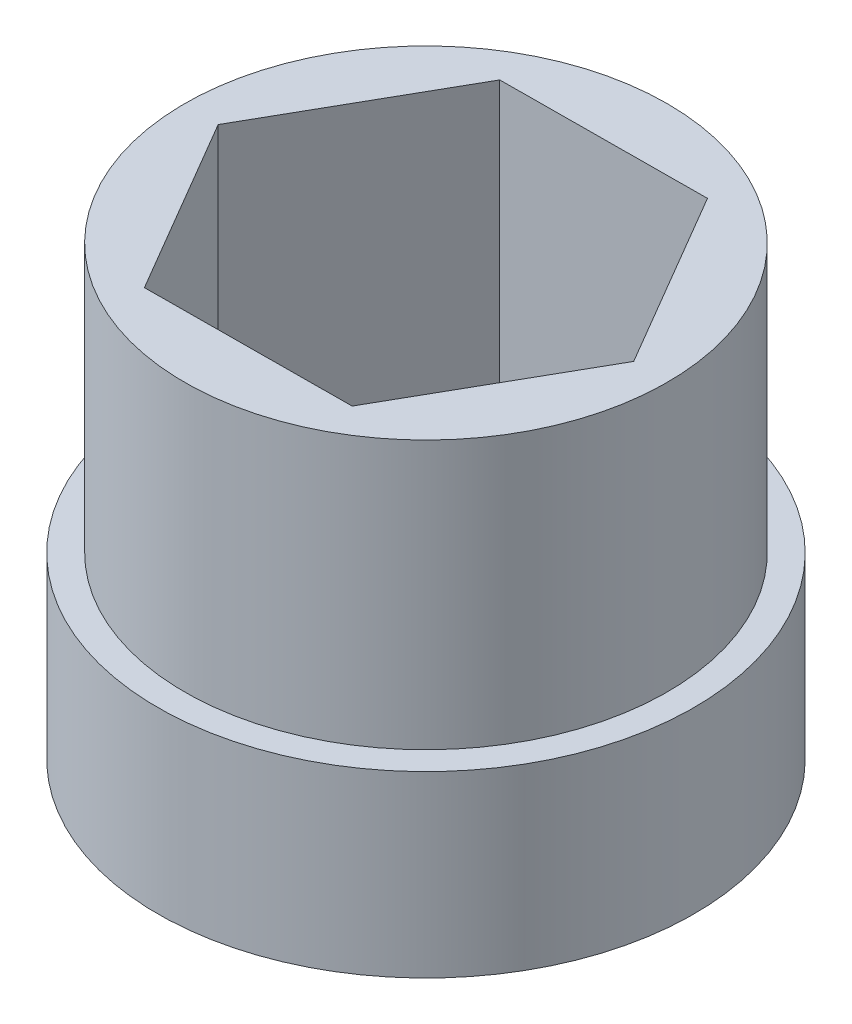
from build123d import *

# Parameters (mm, degrees)
SKETCH1_R           = 8.5725
BOSS_EXTRUDE1_DEPTH = 9.525
SKETCH2_R           = 9.525
BOSS_EXTRUDE2_DEPTH = 3.175
SKETCH3_R           = 9.525
BOSS_EXTRUDE3_DEPTH = 3.175


with BuildPart() as part:
    # Sketch1 → Boss-Extrude1 (new body)
    with BuildSketch(Plane(origin=(0, 0, 0), x_dir=(1, 0, 0), z_dir=(0, 1, 0))):
        with Locations(Location((0, 0, 0), (0, 0, 90))):
            Circle(SKETCH1_R)
        Polygon((3.626024097, 6.373012049), (-3.706178285, 6.326735007), (-7.332202382, -0.046277042), (-3.626024097, -6.373012049), (3.706178285, -6.326735007), (7.332202382, 0.046277042), align=None, mode=Mode.SUBTRACT)
    extrude(amount=BOSS_EXTRUDE1_DEPTH)

    # Sketch2 → Boss-Extrude2 (add)
    with BuildSketch(Plane.XZ):
        with Locations(Location((0, 0, 0), (0, 0, 270))):
            Circle(SKETCH2_R)
    extrude(amount=BOSS_EXTRUDE2_DEPTH)

    # Sketch3 → Boss-Extrude3 (add)
    with BuildSketch(Plane.XZ.offset(3.175)):
        with Locations(Location((0, 0, 0), (0, 0, 270))):
            Circle(SKETCH3_R)
        with BuildLine():
            ThreePointArc((-6.791694669, 0.268500499), (-6.796999648, 0.002188773), (-6.791866186, -0.264126315))
            add(Edge.make_bspline(
                [(-6.791866186, -0.264126315), (-6.828456429, -0.284505488), (-6.88374772, -0.316794554), (-6.957522308, -0.362792819), (-7.015139929, -0.400315137), (-7.073957946, -0.440278462), (-7.133872896, -0.48277978), (-7.194920131, -0.527737667), (-7.267400097, -0.584182527), (-7.324227079, -0.627570578), (-7.360808821, -0.661044511), (-7.368826881, -0.671334712), (-7.375185479, -0.681753711), (-7.380216924, -0.692887617), (-7.383837872, -0.704544545), (-7.386706284, -0.719753225), (-7.386105651, -0.746389435), (-7.381105605, -0.783577736), (-7.376641717, -0.82874241), (-7.3709726, -0.873771681), (-7.367596177, -0.91114239), (-7.362271448, -0.937247863), (-7.356099843, -0.951440926), (-7.34998257, -0.962003796), (-7.342606019, -0.971743703), (-7.334094032, -0.980492038), (-7.32399253, -0.988746564), (-7.280895102, -1.013268793), (-7.215857254, -1.042965715), (-7.132659421, -1.081920666), (-7.06315819, -1.112211845), (-6.995306114, -1.140358941), (-6.929086788, -1.166274715), (-6.864579576, -1.190076694), (-6.782437421, -1.218558205), (-6.721359767, -1.237773588), (-6.681159686, -1.24952561)],
                knots=[6.3172e-05, 6.3172e-05, 6.3172e-05, 6.3172e-05, 0.072334925, 0.110530585, 0.150078376, 0.190978298, 0.233230352, 0.276834537, 0.321790853, 0.391759161, 0.400170221, 0.407178031, 0.414185842, 0.421193653, 0.428201463, 0.435209274, 0.447801873, 0.473901424, 0.5, 0.526098576, 0.552198127, 0.564790726, 0.571798537, 0.578806347, 0.585814158, 0.592821969, 0.599829779, 0.608240839, 0.678209147, 0.723165463, 0.766769648, 0.809021702, 0.849921624, 0.889469415, 0.927665075, 0.999936828, 0.999936828, 0.999936828, 0.999936828], degree=3))
            ThreePointArc((-6.681159686, -1.24952561), (-6.627071723, -1.510340814), (-6.562806286, -1.768836524))
            add(Edge.make_bspline(
                [(-6.562806286, -1.768836524), (-6.593944342, -1.796846843), (-6.640664373, -1.840629825), (-6.702353701, -1.901891208), (-6.750177226, -1.951293889), (-6.798627876, -2.00334349), (-6.8475832, -2.058111543), (-6.897095784, -2.115526529), (-6.955198362, -2.186684508), (-7.000945823, -2.241629924), (-7.029161734, -2.282404798), (-7.03468898, -2.294221189), (-7.038569708, -2.305793883), (-7.040997477, -2.31776824), (-7.04193373, -2.329938642), (-7.041345976, -2.345404291), (-7.034833288, -2.371239022), (-7.021683427, -2.406382319), (-7.007281373, -2.449421312), (-6.991734437, -2.492060107), (-6.980126903, -2.527742531), (-6.969126662, -2.552008621), (-6.959951539, -2.564472523), (-6.951637179, -2.573409339), (-6.942278239, -2.581263608), (-6.932032978, -2.58789851), (-6.920347937, -2.593698281), (-6.872874343, -2.608015607), (-6.802858942, -2.622495683), (-6.71307876, -2.641960692), (-6.638579649, -2.656026929), (-6.566165448, -2.668369812), (-6.495839577, -2.678900637), (-6.427653257, -2.687751645), (-6.341232844, -2.697240716), (-6.27741071, -2.702383272), (-6.235603458, -2.704895287)],
                knots=[6.3172e-05, 6.3172e-05, 6.3172e-05, 6.3172e-05, 0.072334925, 0.110530585, 0.150078376, 0.190978298, 0.233230352, 0.276834537, 0.321790853, 0.391759161, 0.400170221, 0.407178031, 0.414185842, 0.421193653, 0.428201463, 0.435209274, 0.447801873, 0.473901424, 0.5, 0.526098576, 0.552198127, 0.564790726, 0.571798537, 0.578806347, 0.585814158, 0.592821969, 0.599829779, 0.608240839, 0.678209147, 0.723165463, 0.766769648, 0.809021702, 0.849921624, 0.889469415, 0.927665075, 0.999936828, 0.999936828, 0.999936828, 0.999936828], degree=3))
            ThreePointArc((-6.235603458, -2.704895287), (-6.124834751, -2.947135606), (-6.004659875, -3.184849883))
            add(Edge.make_bspline(
                [(-6.004659875, -3.184849883), (-6.028784353, -3.219086795), (-6.064590385, -3.272168231), (-6.111101092, -3.34562083), (-6.146732451, -3.404426618), (-6.182386217, -3.465952511), (-6.21792709, -3.530240999), (-6.253422253, -3.597234058), (-6.294233939, -3.679536998), (-6.326607911, -3.743284585), (-6.345043126, -3.789315779), (-6.347802398, -3.802065836), (-6.349010662, -3.814211921), (-6.348713017, -3.826426286), (-6.346917627, -3.838499886), (-6.342903178, -3.853446991), (-6.330805008, -3.877184782), (-6.310164723, -3.908520845), (-6.286546681, -3.947276002), (-6.261901515, -3.985386235), (-6.24264492, -4.017591106), (-6.226520765, -4.038801011), (-6.214802201, -4.048910759), (-6.204707671, -4.055773391), (-6.193835641, -4.061348178), (-6.182370845, -4.065536943), (-6.169688202, -4.068591136), (-6.120218965, -4.071985629), (-6.048736876, -4.070522766), (-5.956876299, -4.069521777), (-5.881115004, -4.066657732), (-5.807769829, -4.062577477), (-5.736863845, -4.057195294), (-5.668417564, -4.050651506), (-5.582052374, -4.040672315), (-5.518686068, -4.031484175), (-5.477368035, -4.02463022)],
                knots=[6.3172e-05, 6.3172e-05, 6.3172e-05, 6.3172e-05, 0.072334925, 0.110530585, 0.150078376, 0.190978298, 0.233230352, 0.276834537, 0.321790853, 0.391759161, 0.400170221, 0.407178031, 0.414185842, 0.421193653, 0.428201463, 0.435209274, 0.447801873, 0.473901424, 0.5, 0.526098576, 0.552198127, 0.564790726, 0.571798537, 0.578806347, 0.585814158, 0.592821969, 0.599829779, 0.608240839, 0.678209147, 0.723165463, 0.766769648, 0.809021702, 0.849921624, 0.889469415, 0.927665075, 0.999936828, 0.999936828, 0.999936828, 0.999936828], degree=3))
            ThreePointArc((-5.477368035, -4.02463022), (-5.315472988, -4.236148712), (-5.145414745, -4.441161571))
            add(Edge.make_bspline(
                [(-5.145414745, -4.441161571), (-5.161315942, -4.479908293), (-5.184412511, -4.539626458), (-5.213412358, -4.621587053), (-5.235064845, -4.686847181), (-5.256133897, -4.7547642), (-5.276478152, -4.82534943), (-5.296176019, -4.89856125), (-5.317650343, -4.987882137), (-5.33502746, -5.057235326), (-5.342757561, -5.106214643), (-5.342610498, -5.119259025), (-5.34108571, -5.131369447), (-5.338077575, -5.14321134), (-5.333640571, -5.154582718), (-5.326400729, -5.168261769), (-5.30932373, -5.188712308), (-5.28222801, -5.214669814), (-5.250578288, -5.24719779), (-5.218070703, -5.278868454), (-5.192130653, -5.305980886), (-5.171691116, -5.323071053), (-5.158016731, -5.330319703), (-5.146648213, -5.33476403), (-5.13480826, -5.337779791), (-5.122698823, -5.339312379), (-5.109654538, -5.339467843), (-5.060670252, -5.331769288), (-4.991305887, -5.314436841), (-4.901971187, -5.293020048), (-4.828746696, -5.273369336), (-4.758148379, -5.253070545), (-4.690217804, -5.232045238), (-4.624943745, -5.210434786), (-4.542964489, -5.181487732), (-4.483231462, -5.158429628), (-4.444474507, -5.142553389)],
                knots=[6.3172e-05, 6.3172e-05, 6.3172e-05, 6.3172e-05, 0.072334925, 0.110530585, 0.150078376, 0.190978298, 0.233230352, 0.276834537, 0.321790853, 0.391759161, 0.400170221, 0.407178031, 0.414185842, 0.421193653, 0.428201463, 0.435209274, 0.447801873, 0.473901424, 0.5, 0.526098576, 0.552198127, 0.564790726, 0.571798537, 0.578806347, 0.585814158, 0.592821969, 0.599829779, 0.608240839, 0.678209147, 0.723165463, 0.766769648, 0.809021702, 0.849921624, 0.889469415, 0.927665075, 0.999936828, 0.999936828, 0.999936828, 0.999936828], degree=3))
            ThreePointArc((-4.444474507, -5.142553389), (-4.239571215, -5.312743633), (-4.028157034, -5.474774873))
            add(Edge.make_bspline(
                [(-4.028157034, -5.474774873), (-4.035037598, -5.516088483), (-4.044266546, -5.579448859), (-4.054301358, -5.665807603), (-4.060889227, -5.734249656), (-4.066317075, -5.805152159), (-4.070444567, -5.878494691), (-4.073357405, -5.954254126), (-4.074417555, -6.046114039), (-4.075926455, -6.117595171), (-4.072563823, -6.167066584), (-4.069517799, -6.179751191), (-4.065336418, -6.191218682), (-4.059768635, -6.202094301), (-4.052912505, -6.212193249), (-4.042810306, -6.223918321), (-4.02161079, -6.240056132), (-3.989418328, -6.259333465), (-3.951323975, -6.284003171), (-3.912584038, -6.307646167), (-3.881261275, -6.32830663), (-3.85753128, -6.340420085), (-3.842586764, -6.34444416), (-3.830514322, -6.346247325), (-3.818300152, -6.346552837), (-3.806153291, -6.345352396), (-3.793401459, -6.342601336), (-3.747358402, -6.324195771), (-3.683589978, -6.291862861), (-3.601260771, -6.251104191), (-3.534244865, -6.215652182), (-3.469933501, -6.18015272), (-3.408384659, -6.144538587), (-3.349555934, -6.108945109), (-3.276073395, -6.062481717), (-3.22296891, -6.02670988), (-3.188716469, -6.002607457)],
                knots=[6.3172e-05, 6.3172e-05, 6.3172e-05, 6.3172e-05, 0.072334925, 0.110530585, 0.150078376, 0.190978298, 0.233230352, 0.276834537, 0.321790853, 0.391759161, 0.400170221, 0.407178031, 0.414185842, 0.421193653, 0.428201463, 0.435209274, 0.447801873, 0.473901424, 0.5, 0.526098576, 0.552198127, 0.564790726, 0.571798537, 0.578806347, 0.585814158, 0.592821969, 0.599829779, 0.608240839, 0.678209147, 0.723165463, 0.766769648, 0.809021702, 0.849921624, 0.889469415, 0.927665075, 0.999936828, 0.999936828, 0.999936828, 0.999936828], degree=3))
            ThreePointArc((-3.188716469, -6.002607457), (-2.951079638, -6.122935405), (-2.708910709, -6.233860102))
            add(Edge.make_bspline(
                [(-2.708910709, -6.233860102), (-2.70642562, -6.275668963), (-2.701324169, -6.339494396), (-2.691890759, -6.425920902), (-2.683083667, -6.494112908), (-2.672598137, -6.564445547), (-2.660301894, -6.636867683), (-2.646283641, -6.711375838), (-2.626876458, -6.801168537), (-2.612441478, -6.871193249), (-2.598154729, -6.918676054), (-2.592362485, -6.930364828), (-2.585734183, -6.94061436), (-2.577885943, -6.949978356), (-2.568954484, -6.95829847), (-2.556496494, -6.967481619), (-2.532237493, -6.978497486), (-2.496562553, -6.990127999), (-2.453933779, -7.005702393), (-2.410904071, -7.020132163), (-2.37576925, -7.033304654), (-2.349938718, -7.039833979), (-2.334473451, -7.040431694), (-2.322302449, -7.03950328), (-2.310326531, -7.037083223), (-2.29875134, -7.033209949), (-2.286931392, -7.027690314), (-2.246138354, -6.99950067), (-2.191163486, -6.953788605), (-2.119968101, -6.895731868), (-2.062521239, -6.846256272), (-2.007721669, -6.797336231), (-1.955640874, -6.748919113), (-1.906207402, -6.701127415), (-1.844906302, -6.639477555), (-1.80109324, -6.592785732), (-1.773062872, -6.561665722)],
                knots=[6.3172e-05, 6.3172e-05, 6.3172e-05, 6.3172e-05, 0.072334925, 0.110530585, 0.150078376, 0.190978298, 0.233230352, 0.276834537, 0.321790853, 0.391759161, 0.400170221, 0.407178031, 0.414185842, 0.421193653, 0.428201463, 0.435209274, 0.447801873, 0.473901424, 0.5, 0.526098576, 0.552198127, 0.564790726, 0.571798537, 0.578806347, 0.585814158, 0.592821969, 0.599829779, 0.608240839, 0.678209147, 0.723165463, 0.766769648, 0.809021702, 0.849921624, 0.889469415, 0.927665075, 0.999936828, 0.999936828, 0.999936828, 0.999936828], degree=3))
            ThreePointArc((-1.773062872, -6.561665722), (-1.514608605, -6.626097628), (-1.25382829, -6.680353555))
            add(Edge.make_bspline(
                [(-1.25382829, -6.680353555), (-1.242102161, -6.720561196), (-1.222926119, -6.781651213), (-1.194497516, -6.863811695), (-1.170737088, -6.928334222), (-1.144863967, -6.994570225), (-1.116760576, -7.062440416), (-1.086514166, -7.131961141), (-1.047612806, -7.215184045), (-1.017957777, -7.280241006), (-0.993463308, -7.323354218), (-0.985215291, -7.333461034), (-0.976472439, -7.341978653), (-0.966737285, -7.349361476), (-0.956178357, -7.355485551), (-0.941989272, -7.361666296), (-0.915887234, -7.367007836), (-0.878518706, -7.370408327), (-0.833493097, -7.376106443), (-0.788331307, -7.380599418), (-0.751146234, -7.385623414), (-0.724510416, -7.386241202), (-0.709299892, -7.383382585), (-0.697640634, -7.379769145), (-0.68650349, -7.374744872), (-0.676080398, -7.368392986), (-0.665785035, -7.360381555), (-0.632287549, -7.323821379), (-0.588862908, -7.267022352), (-0.532371379, -7.194578755), (-0.487374185, -7.133560486), (-0.444834288, -7.073672921), (-0.40483309, -7.014880654), (-0.367273672, -6.957287212), (-0.321227902, -6.883542264), (-0.288903233, -6.828271779), (-0.268500499, -6.791694669)],
                knots=[6.3172e-05, 6.3172e-05, 6.3172e-05, 6.3172e-05, 0.072334925, 0.110530585, 0.150078376, 0.190978298, 0.233230352, 0.276834537, 0.321790853, 0.391759161, 0.400170221, 0.407178031, 0.414185842, 0.421193653, 0.428201463, 0.435209274, 0.447801873, 0.473901424, 0.5, 0.526098576, 0.552198127, 0.564790726, 0.571798537, 0.578806347, 0.585814158, 0.592821969, 0.599829779, 0.608240839, 0.678209147, 0.723165463, 0.766769648, 0.809021702, 0.849921624, 0.889469415, 0.927665075, 0.999936828, 0.999936828, 0.999936828, 0.999936828], degree=3))
            ThreePointArc((-0.268500499, -6.791694669), (-0.002188773, -6.796999648), (0.264126315, -6.791866186))
            add(Edge.make_bspline(
                [(0.264126315, -6.791866186), (0.284505488, -6.828456429), (0.316794554, -6.88374772), (0.362792819, -6.957522308), (0.400315137, -7.015139929), (0.440278462, -7.073957946), (0.48277978, -7.133872896), (0.527737667, -7.194920131), (0.584182527, -7.267400097), (0.627570578, -7.324227079), (0.661044511, -7.360808821), (0.671334712, -7.368826881), (0.681753711, -7.375185479), (0.692887617, -7.380216924), (0.704544545, -7.383837872), (0.719753225, -7.386706284), (0.746389435, -7.386105651), (0.783577736, -7.381105605), (0.82874241, -7.376641717), (0.873771681, -7.3709726), (0.91114239, -7.367596177), (0.937247863, -7.362271448), (0.951440926, -7.356099843), (0.962003796, -7.34998257), (0.971743703, -7.342606019), (0.980492038, -7.334094032), (0.988746564, -7.32399253), (1.013268793, -7.280895102), (1.042965715, -7.215857254), (1.081920666, -7.132659421), (1.112211845, -7.06315819), (1.140358941, -6.995306114), (1.166274715, -6.929086788), (1.190076694, -6.864579576), (1.218558205, -6.782437421), (1.237773588, -6.721359767), (1.24952561, -6.681159686)],
                knots=[6.3172e-05, 6.3172e-05, 6.3172e-05, 6.3172e-05, 0.072334925, 0.110530585, 0.150078376, 0.190978298, 0.233230352, 0.276834537, 0.321790853, 0.391759161, 0.400170221, 0.407178031, 0.414185842, 0.421193653, 0.428201463, 0.435209274, 0.447801873, 0.473901424, 0.5, 0.526098576, 0.552198127, 0.564790726, 0.571798537, 0.578806347, 0.585814158, 0.592821969, 0.599829779, 0.608240839, 0.678209147, 0.723165463, 0.766769648, 0.809021702, 0.849921624, 0.889469415, 0.927665075, 0.999936828, 0.999936828, 0.999936828, 0.999936828], degree=3))
            ThreePointArc((1.24952561, -6.681159686), (1.510340814, -6.627071723), (1.768836524, -6.562806286))
            add(Edge.make_bspline(
                [(1.768836524, -6.562806286), (1.796846843, -6.593944342), (1.840629825, -6.640664373), (1.901891208, -6.702353701), (1.951293889, -6.750177226), (2.00334349, -6.798627876), (2.058111543, -6.8475832), (2.115526529, -6.897095784), (2.186684508, -6.955198362), (2.241629924, -7.000945823), (2.282404798, -7.029161734), (2.294221189, -7.03468898), (2.305793883, -7.038569708), (2.31776824, -7.040997477), (2.329938642, -7.04193373), (2.345404291, -7.041345976), (2.371239022, -7.034833288), (2.406382319, -7.021683427), (2.449421312, -7.007281373), (2.492060107, -6.991734437), (2.527742531, -6.980126903), (2.552008621, -6.969126662), (2.564472523, -6.959951539), (2.573409339, -6.951637179), (2.581263608, -6.942278239), (2.58789851, -6.932032978), (2.593698281, -6.920347937), (2.608015607, -6.872874343), (2.622495683, -6.802858942), (2.641960692, -6.71307876), (2.656026929, -6.638579649), (2.668369812, -6.566165448), (2.678900637, -6.495839577), (2.687751645, -6.427653257), (2.697240716, -6.341232844), (2.702383272, -6.27741071), (2.704895287, -6.235603458)],
                knots=[6.3172e-05, 6.3172e-05, 6.3172e-05, 6.3172e-05, 0.072334925, 0.110530585, 0.150078376, 0.190978298, 0.233230352, 0.276834537, 0.321790853, 0.391759161, 0.400170221, 0.407178031, 0.414185842, 0.421193653, 0.428201463, 0.435209274, 0.447801873, 0.473901424, 0.5, 0.526098576, 0.552198127, 0.564790726, 0.571798537, 0.578806347, 0.585814158, 0.592821969, 0.599829779, 0.608240839, 0.678209147, 0.723165463, 0.766769648, 0.809021702, 0.849921624, 0.889469415, 0.927665075, 0.999936828, 0.999936828, 0.999936828, 0.999936828], degree=3))
            ThreePointArc((2.704895287, -6.235603458), (2.947135606, -6.124834751), (3.184849883, -6.004659875))
            add(Edge.make_bspline(
                [(3.184849883, -6.004659875), (3.219086795, -6.028784353), (3.272168231, -6.064590385), (3.34562083, -6.111101092), (3.404426618, -6.146732451), (3.465952511, -6.182386217), (3.530240999, -6.21792709), (3.597234058, -6.253422253), (3.679536998, -6.294233939), (3.743284585, -6.326607911), (3.789315779, -6.345043126), (3.802065836, -6.347802398), (3.814211921, -6.349010662), (3.826426286, -6.348713017), (3.838499886, -6.346917627), (3.853446991, -6.342903178), (3.877184782, -6.330805008), (3.908520845, -6.310164723), (3.947276002, -6.286546681), (3.985386235, -6.261901515), (4.017591106, -6.24264492), (4.038801011, -6.226520765), (4.048910759, -6.214802201), (4.055773391, -6.204707671), (4.061348178, -6.193835641), (4.065536943, -6.182370845), (4.068591136, -6.169688202), (4.071985629, -6.120218965), (4.070522766, -6.048736876), (4.069521777, -5.956876299), (4.066657732, -5.881115004), (4.062577477, -5.807769829), (4.057195294, -5.736863845), (4.050651506, -5.668417564), (4.040672315, -5.582052374), (4.031484175, -5.518686068), (4.02463022, -5.477368035)],
                knots=[6.3172e-05, 6.3172e-05, 6.3172e-05, 6.3172e-05, 0.072334925, 0.110530585, 0.150078376, 0.190978298, 0.233230352, 0.276834537, 0.321790853, 0.391759161, 0.400170221, 0.407178031, 0.414185842, 0.421193653, 0.428201463, 0.435209274, 0.447801873, 0.473901424, 0.5, 0.526098576, 0.552198127, 0.564790726, 0.571798537, 0.578806347, 0.585814158, 0.592821969, 0.599829779, 0.608240839, 0.678209147, 0.723165463, 0.766769648, 0.809021702, 0.849921624, 0.889469415, 0.927665075, 0.999936828, 0.999936828, 0.999936828, 0.999936828], degree=3))
            ThreePointArc((4.02463022, -5.477368035), (4.236148712, -5.315472988), (4.441161571, -5.145414745))
            add(Edge.make_bspline(
                [(4.441161571, -5.145414745), (4.479908293, -5.161315942), (4.539626458, -5.184412511), (4.621587053, -5.213412358), (4.686847181, -5.235064845), (4.7547642, -5.256133897), (4.82534943, -5.276478152), (4.89856125, -5.296176019), (4.987882137, -5.317650343), (5.057235326, -5.33502746), (5.106214643, -5.342757561), (5.119259025, -5.342610498), (5.131369447, -5.34108571), (5.14321134, -5.338077575), (5.154582718, -5.333640571), (5.168261769, -5.326400729), (5.188712308, -5.30932373), (5.214669814, -5.28222801), (5.24719779, -5.250578288), (5.278868454, -5.218070703), (5.305980886, -5.192130653), (5.323071053, -5.171691116), (5.330319703, -5.158016731), (5.33476403, -5.146648213), (5.337779791, -5.13480826), (5.339312379, -5.122698823), (5.339467843, -5.109654538), (5.331769288, -5.060670252), (5.314436841, -4.991305887), (5.293020048, -4.901971187), (5.273369336, -4.828746696), (5.253070545, -4.758148379), (5.232045238, -4.690217804), (5.210434786, -4.624943745), (5.181487732, -4.542964489), (5.158429628, -4.483231462), (5.142553389, -4.444474507)],
                knots=[6.3172e-05, 6.3172e-05, 6.3172e-05, 6.3172e-05, 0.072334925, 0.110530585, 0.150078376, 0.190978298, 0.233230352, 0.276834537, 0.321790853, 0.391759161, 0.400170221, 0.407178031, 0.414185842, 0.421193653, 0.428201463, 0.435209274, 0.447801873, 0.473901424, 0.5, 0.526098576, 0.552198127, 0.564790726, 0.571798537, 0.578806347, 0.585814158, 0.592821969, 0.599829779, 0.608240839, 0.678209147, 0.723165463, 0.766769648, 0.809021702, 0.849921624, 0.889469415, 0.927665075, 0.999936828, 0.999936828, 0.999936828, 0.999936828], degree=3))
            ThreePointArc((5.142553389, -4.444474507), (5.312743633, -4.239571215), (5.474774873, -4.028157034))
            add(Edge.make_bspline(
                [(5.474774873, -4.028157034), (5.516088483, -4.035037598), (5.579448859, -4.044266546), (5.665807603, -4.054301358), (5.734249656, -4.060889227), (5.805152159, -4.066317075), (5.878494691, -4.070444567), (5.954254126, -4.073357405), (6.046114039, -4.074417555), (6.117595171, -4.075926455), (6.167066584, -4.072563823), (6.179751191, -4.069517799), (6.191218682, -4.065336418), (6.202094301, -4.059768635), (6.212193249, -4.052912505), (6.223918321, -4.042810306), (6.240056132, -4.02161079), (6.259333465, -3.989418328), (6.284003171, -3.951323975), (6.307646167, -3.912584038), (6.32830663, -3.881261275), (6.340420085, -3.85753128), (6.34444416, -3.842586764), (6.346247325, -3.830514322), (6.346552837, -3.818300152), (6.345352396, -3.806153291), (6.342601336, -3.793401459), (6.324195771, -3.747358402), (6.291862861, -3.683589978), (6.251104191, -3.601260771), (6.215652182, -3.534244865), (6.18015272, -3.469933501), (6.144538587, -3.408384659), (6.108945109, -3.349555934), (6.062481717, -3.276073395), (6.02670988, -3.22296891), (6.002607457, -3.188716469)],
                knots=[6.3172e-05, 6.3172e-05, 6.3172e-05, 6.3172e-05, 0.072334925, 0.110530585, 0.150078376, 0.190978298, 0.233230352, 0.276834537, 0.321790853, 0.391759161, 0.400170221, 0.407178031, 0.414185842, 0.421193653, 0.428201463, 0.435209274, 0.447801873, 0.473901424, 0.5, 0.526098576, 0.552198127, 0.564790726, 0.571798537, 0.578806347, 0.585814158, 0.592821969, 0.599829779, 0.608240839, 0.678209147, 0.723165463, 0.766769648, 0.809021702, 0.849921624, 0.889469415, 0.927665075, 0.999936828, 0.999936828, 0.999936828, 0.999936828], degree=3))
            ThreePointArc((6.002607457, -3.188716469), (6.122935405, -2.951079638), (6.233860102, -2.708910709))
            add(Edge.make_bspline(
                [(6.233860102, -2.708910709), (6.275668963, -2.70642562), (6.339494396, -2.701324169), (6.425920902, -2.691890759), (6.494112908, -2.683083667), (6.564445547, -2.672598137), (6.636867683, -2.660301894), (6.711375838, -2.646283641), (6.801168537, -2.626876458), (6.871193249, -2.612441478), (6.918676054, -2.598154729), (6.930364828, -2.592362485), (6.94061436, -2.585734183), (6.949978356, -2.577885943), (6.95829847, -2.568954484), (6.967481619, -2.556496494), (6.978497486, -2.532237493), (6.990127999, -2.496562553), (7.005702393, -2.453933779), (7.020132163, -2.410904071), (7.033304654, -2.37576925), (7.039833979, -2.349938718), (7.040431694, -2.334473451), (7.03950328, -2.322302449), (7.037083223, -2.310326531), (7.033209949, -2.29875134), (7.027690314, -2.286931392), (6.99950067, -2.246138354), (6.953788605, -2.191163486), (6.895731868, -2.119968101), (6.846256272, -2.062521239), (6.797336231, -2.007721669), (6.748919113, -1.955640874), (6.701127415, -1.906207402), (6.639477555, -1.844906302), (6.592785732, -1.80109324), (6.561665722, -1.773062872)],
                knots=[6.3172e-05, 6.3172e-05, 6.3172e-05, 6.3172e-05, 0.072334925, 0.110530585, 0.150078376, 0.190978298, 0.233230352, 0.276834537, 0.321790853, 0.391759161, 0.400170221, 0.407178031, 0.414185842, 0.421193653, 0.428201463, 0.435209274, 0.447801873, 0.473901424, 0.5, 0.526098576, 0.552198127, 0.564790726, 0.571798537, 0.578806347, 0.585814158, 0.592821969, 0.599829779, 0.608240839, 0.678209147, 0.723165463, 0.766769648, 0.809021702, 0.849921624, 0.889469415, 0.927665075, 0.999936828, 0.999936828, 0.999936828, 0.999936828], degree=3))
            ThreePointArc((6.561665722, -1.773062872), (6.626097628, -1.514608605), (6.680353555, -1.25382829))
            add(Edge.make_bspline(
                [(6.680353555, -1.25382829), (6.720561196, -1.242102161), (6.781651213, -1.222926119), (6.863811695, -1.194497516), (6.928334222, -1.170737088), (6.994570225, -1.144863967), (7.062440416, -1.116760576), (7.131961141, -1.086514166), (7.215184045, -1.047612806), (7.280241006, -1.017957777), (7.323354218, -0.993463308), (7.333461034, -0.985215291), (7.341978653, -0.976472439), (7.349361476, -0.966737285), (7.355485551, -0.956178357), (7.361666296, -0.941989272), (7.367007836, -0.915887234), (7.370408327, -0.878518706), (7.376106443, -0.833493097), (7.380599418, -0.788331307), (7.385623414, -0.751146234), (7.386241202, -0.724510416), (7.383382585, -0.709299892), (7.379769145, -0.697640634), (7.374744872, -0.68650349), (7.368392986, -0.676080398), (7.360381555, -0.665785035), (7.323821379, -0.632287549), (7.267022352, -0.588862908), (7.194578755, -0.532371379), (7.133560486, -0.487374185), (7.073672921, -0.444834288), (7.014880654, -0.40483309), (6.957287212, -0.367273672), (6.883542264, -0.321227902), (6.828271779, -0.288903233), (6.791694669, -0.268500499)],
                knots=[6.3172e-05, 6.3172e-05, 6.3172e-05, 6.3172e-05, 0.072334925, 0.110530585, 0.150078376, 0.190978298, 0.233230352, 0.276834537, 0.321790853, 0.391759161, 0.400170221, 0.407178031, 0.414185842, 0.421193653, 0.428201463, 0.435209274, 0.447801873, 0.473901424, 0.5, 0.526098576, 0.552198127, 0.564790726, 0.571798537, 0.578806347, 0.585814158, 0.592821969, 0.599829779, 0.608240839, 0.678209147, 0.723165463, 0.766769648, 0.809021702, 0.849921624, 0.889469415, 0.927665075, 0.999936828, 0.999936828, 0.999936828, 0.999936828], degree=3))
            ThreePointArc((6.791694669, -0.268500499), (6.796999648, -0.002188773), (6.791866186, 0.264126315))
            add(Edge.make_bspline(
                [(6.791866186, 0.264126315), (6.828456429, 0.284505488), (6.88374772, 0.316794554), (6.957522308, 0.362792819), (7.015139929, 0.400315137), (7.073957946, 0.440278462), (7.133872896, 0.48277978), (7.194920131, 0.527737667), (7.267400097, 0.584182527), (7.324227079, 0.627570578), (7.360808821, 0.661044511), (7.368826881, 0.671334712), (7.375185479, 0.681753711), (7.380216924, 0.692887617), (7.383837872, 0.704544545), (7.386706284, 0.719753225), (7.386105651, 0.746389435), (7.381105605, 0.783577736), (7.376641717, 0.82874241), (7.3709726, 0.873771681), (7.367596177, 0.91114239), (7.362271448, 0.937247863), (7.356099843, 0.951440926), (7.34998257, 0.962003796), (7.342606019, 0.971743703), (7.334094032, 0.980492038), (7.32399253, 0.988746564), (7.280895102, 1.013268793), (7.215857254, 1.042965715), (7.132659421, 1.081920666), (7.06315819, 1.112211845), (6.995306114, 1.140358941), (6.929086788, 1.166274715), (6.864579576, 1.190076694), (6.782437421, 1.218558205), (6.721359767, 1.237773588), (6.681159686, 1.24952561)],
                knots=[6.3172e-05, 6.3172e-05, 6.3172e-05, 6.3172e-05, 0.072334925, 0.110530585, 0.150078376, 0.190978298, 0.233230352, 0.276834537, 0.321790853, 0.391759161, 0.400170221, 0.407178031, 0.414185842, 0.421193653, 0.428201463, 0.435209274, 0.447801873, 0.473901424, 0.5, 0.526098576, 0.552198127, 0.564790726, 0.571798537, 0.578806347, 0.585814158, 0.592821969, 0.599829779, 0.608240839, 0.678209147, 0.723165463, 0.766769648, 0.809021702, 0.849921624, 0.889469415, 0.927665075, 0.999936828, 0.999936828, 0.999936828, 0.999936828], degree=3))
            ThreePointArc((6.681159686, 1.24952561), (6.627071723, 1.510340814), (6.562806286, 1.768836524))
            add(Edge.make_bspline(
                [(6.562806286, 1.768836524), (6.593944342, 1.796846843), (6.640664373, 1.840629825), (6.702353701, 1.901891208), (6.750177226, 1.951293889), (6.798627876, 2.00334349), (6.8475832, 2.058111543), (6.897095784, 2.115526529), (6.955198362, 2.186684508), (7.000945823, 2.241629924), (7.029161734, 2.282404798), (7.03468898, 2.294221189), (7.038569708, 2.305793883), (7.040997477, 2.31776824), (7.04193373, 2.329938642), (7.041345976, 2.345404291), (7.034833288, 2.371239022), (7.021683427, 2.406382319), (7.007281373, 2.449421312), (6.991734437, 2.492060107), (6.980126903, 2.527742531), (6.969126662, 2.552008621), (6.959951539, 2.564472523), (6.951637179, 2.573409339), (6.942278239, 2.581263608), (6.932032978, 2.58789851), (6.920347937, 2.593698281), (6.872874343, 2.608015607), (6.802858942, 2.622495683), (6.71307876, 2.641960692), (6.638579649, 2.656026929), (6.566165448, 2.668369812), (6.495839577, 2.678900637), (6.427653257, 2.687751645), (6.341232844, 2.697240716), (6.27741071, 2.702383272), (6.235603458, 2.704895287)],
                knots=[6.3172e-05, 6.3172e-05, 6.3172e-05, 6.3172e-05, 0.072334925, 0.110530585, 0.150078376, 0.190978298, 0.233230352, 0.276834537, 0.321790853, 0.391759161, 0.400170221, 0.407178031, 0.414185842, 0.421193653, 0.428201463, 0.435209274, 0.447801873, 0.473901424, 0.5, 0.526098576, 0.552198127, 0.564790726, 0.571798537, 0.578806347, 0.585814158, 0.592821969, 0.599829779, 0.608240839, 0.678209147, 0.723165463, 0.766769648, 0.809021702, 0.849921624, 0.889469415, 0.927665075, 0.999936828, 0.999936828, 0.999936828, 0.999936828], degree=3))
            ThreePointArc((6.235603458, 2.704895287), (6.124834751, 2.947135606), (6.004659875, 3.184849883))
            add(Edge.make_bspline(
                [(6.004659875, 3.184849883), (6.028784353, 3.219086795), (6.064590385, 3.272168231), (6.111101092, 3.34562083), (6.146732451, 3.404426618), (6.182386217, 3.465952511), (6.21792709, 3.530240999), (6.253422253, 3.597234058), (6.294233939, 3.679536998), (6.326607911, 3.743284585), (6.345043126, 3.789315779), (6.347802398, 3.802065836), (6.349010662, 3.814211921), (6.348713017, 3.826426286), (6.346917627, 3.838499886), (6.342903178, 3.853446991), (6.330805008, 3.877184782), (6.310164723, 3.908520845), (6.286546681, 3.947276002), (6.261901515, 3.985386235), (6.24264492, 4.017591106), (6.226520765, 4.038801011), (6.214802201, 4.048910759), (6.204707671, 4.055773391), (6.193835641, 4.061348178), (6.182370845, 4.065536943), (6.169688202, 4.068591136), (6.120218965, 4.071985629), (6.048736876, 4.070522766), (5.956876299, 4.069521777), (5.881115004, 4.066657732), (5.807769829, 4.062577477), (5.736863845, 4.057195294), (5.668417564, 4.050651506), (5.582052374, 4.040672315), (5.518686068, 4.031484175), (5.477368035, 4.02463022)],
                knots=[6.3172e-05, 6.3172e-05, 6.3172e-05, 6.3172e-05, 0.072334925, 0.110530585, 0.150078376, 0.190978298, 0.233230352, 0.276834537, 0.321790853, 0.391759161, 0.400170221, 0.407178031, 0.414185842, 0.421193653, 0.428201463, 0.435209274, 0.447801873, 0.473901424, 0.5, 0.526098576, 0.552198127, 0.564790726, 0.571798537, 0.578806347, 0.585814158, 0.592821969, 0.599829779, 0.608240839, 0.678209147, 0.723165463, 0.766769648, 0.809021702, 0.849921624, 0.889469415, 0.927665075, 0.999936828, 0.999936828, 0.999936828, 0.999936828], degree=3))
            ThreePointArc((5.477368035, 4.02463022), (5.315472988, 4.236148712), (5.145414745, 4.441161571))
            add(Edge.make_bspline(
                [(5.145414745, 4.441161571), (5.161315942, 4.479908293), (5.184412511, 4.539626458), (5.213412358, 4.621587053), (5.235064845, 4.686847181), (5.256133897, 4.7547642), (5.276478152, 4.82534943), (5.296176019, 4.89856125), (5.317650343, 4.987882137), (5.33502746, 5.057235326), (5.342757561, 5.106214643), (5.342610498, 5.119259025), (5.34108571, 5.131369447), (5.338077575, 5.14321134), (5.333640571, 5.154582718), (5.326400729, 5.168261769), (5.30932373, 5.188712308), (5.28222801, 5.214669814), (5.250578288, 5.24719779), (5.218070703, 5.278868454), (5.192130653, 5.305980886), (5.171691116, 5.323071053), (5.158016731, 5.330319703), (5.146648213, 5.33476403), (5.13480826, 5.337779791), (5.122698823, 5.339312379), (5.109654538, 5.339467843), (5.060670252, 5.331769288), (4.991305887, 5.314436841), (4.901971187, 5.293020048), (4.828746696, 5.273369336), (4.758148379, 5.253070545), (4.690217804, 5.232045238), (4.624943745, 5.210434786), (4.542964489, 5.181487732), (4.483231462, 5.158429628), (4.444474507, 5.142553389)],
                knots=[6.3172e-05, 6.3172e-05, 6.3172e-05, 6.3172e-05, 0.072334925, 0.110530585, 0.150078376, 0.190978298, 0.233230352, 0.276834537, 0.321790853, 0.391759161, 0.400170221, 0.407178031, 0.414185842, 0.421193653, 0.428201463, 0.435209274, 0.447801873, 0.473901424, 0.5, 0.526098576, 0.552198127, 0.564790726, 0.571798537, 0.578806347, 0.585814158, 0.592821969, 0.599829779, 0.608240839, 0.678209147, 0.723165463, 0.766769648, 0.809021702, 0.849921624, 0.889469415, 0.927665075, 0.999936828, 0.999936828, 0.999936828, 0.999936828], degree=3))
            ThreePointArc((4.444474507, 5.142553389), (4.239571215, 5.312743633), (4.028157034, 5.474774873))
            add(Edge.make_bspline(
                [(4.028157034, 5.474774873), (4.035037598, 5.516088483), (4.044266546, 5.579448859), (4.054301358, 5.665807603), (4.060889227, 5.734249656), (4.066317075, 5.805152159), (4.070444567, 5.878494691), (4.073357405, 5.954254126), (4.074417555, 6.046114039), (4.075926455, 6.117595171), (4.072563823, 6.167066584), (4.069517799, 6.179751191), (4.065336418, 6.191218682), (4.059768635, 6.202094301), (4.052912505, 6.212193249), (4.042810306, 6.223918321), (4.02161079, 6.240056132), (3.989418328, 6.259333465), (3.951323975, 6.284003171), (3.912584038, 6.307646167), (3.881261275, 6.32830663), (3.85753128, 6.340420085), (3.842586764, 6.34444416), (3.830514322, 6.346247325), (3.818300152, 6.346552837), (3.806153291, 6.345352396), (3.793401459, 6.342601336), (3.747358402, 6.324195771), (3.683589978, 6.291862861), (3.601260771, 6.251104191), (3.534244865, 6.215652182), (3.469933501, 6.18015272), (3.408384659, 6.144538587), (3.349555934, 6.108945109), (3.276073395, 6.062481717), (3.22296891, 6.02670988), (3.188716469, 6.002607457)],
                knots=[6.3172e-05, 6.3172e-05, 6.3172e-05, 6.3172e-05, 0.072334925, 0.110530585, 0.150078376, 0.190978298, 0.233230352, 0.276834537, 0.321790853, 0.391759161, 0.400170221, 0.407178031, 0.414185842, 0.421193653, 0.428201463, 0.435209274, 0.447801873, 0.473901424, 0.5, 0.526098576, 0.552198127, 0.564790726, 0.571798537, 0.578806347, 0.585814158, 0.592821969, 0.599829779, 0.608240839, 0.678209147, 0.723165463, 0.766769648, 0.809021702, 0.849921624, 0.889469415, 0.927665075, 0.999936828, 0.999936828, 0.999936828, 0.999936828], degree=3))
            ThreePointArc((3.188716469, 6.002607457), (2.951079638, 6.122935405), (2.708910709, 6.233860102))
            add(Edge.make_bspline(
                [(2.708910709, 6.233860102), (2.70642562, 6.275668963), (2.701324169, 6.339494396), (2.691890759, 6.425920902), (2.683083667, 6.494112908), (2.672598137, 6.564445547), (2.660301894, 6.636867683), (2.646283641, 6.711375838), (2.626876458, 6.801168537), (2.612441478, 6.871193249), (2.598154729, 6.918676054), (2.592362485, 6.930364828), (2.585734183, 6.94061436), (2.577885943, 6.949978356), (2.568954484, 6.95829847), (2.556496494, 6.967481619), (2.532237493, 6.978497486), (2.496562553, 6.990127999), (2.453933779, 7.005702393), (2.410904071, 7.020132163), (2.37576925, 7.033304654), (2.349938718, 7.039833979), (2.334473451, 7.040431694), (2.322302449, 7.03950328), (2.310326531, 7.037083223), (2.29875134, 7.033209949), (2.286931392, 7.027690314), (2.246138354, 6.99950067), (2.191163486, 6.953788605), (2.119968101, 6.895731868), (2.062521239, 6.846256272), (2.007721669, 6.797336231), (1.955640874, 6.748919113), (1.906207402, 6.701127415), (1.844906302, 6.639477555), (1.80109324, 6.592785732), (1.773062872, 6.561665722)],
                knots=[6.3172e-05, 6.3172e-05, 6.3172e-05, 6.3172e-05, 0.072334925, 0.110530585, 0.150078376, 0.190978298, 0.233230352, 0.276834537, 0.321790853, 0.391759161, 0.400170221, 0.407178031, 0.414185842, 0.421193653, 0.428201463, 0.435209274, 0.447801873, 0.473901424, 0.5, 0.526098576, 0.552198127, 0.564790726, 0.571798537, 0.578806347, 0.585814158, 0.592821969, 0.599829779, 0.608240839, 0.678209147, 0.723165463, 0.766769648, 0.809021702, 0.849921624, 0.889469415, 0.927665075, 0.999936828, 0.999936828, 0.999936828, 0.999936828], degree=3))
            ThreePointArc((1.773062872, 6.561665722), (1.514608605, 6.626097628), (1.25382829, 6.680353555))
            add(Edge.make_bspline(
                [(1.25382829, 6.680353555), (1.242102161, 6.720561196), (1.222926119, 6.781651213), (1.194497516, 6.863811695), (1.170737088, 6.928334222), (1.144863967, 6.994570225), (1.116760576, 7.062440416), (1.086514166, 7.131961141), (1.047612806, 7.215184045), (1.017957777, 7.280241006), (0.993463308, 7.323354218), (0.985215291, 7.333461034), (0.976472439, 7.341978653), (0.966737285, 7.349361476), (0.956178357, 7.355485551), (0.941989272, 7.361666296), (0.915887234, 7.367007836), (0.878518706, 7.370408327), (0.833493097, 7.376106443), (0.788331307, 7.380599418), (0.751146234, 7.385623414), (0.724510416, 7.386241202), (0.709299892, 7.383382585), (0.697640634, 7.379769145), (0.68650349, 7.374744872), (0.676080398, 7.368392986), (0.665785035, 7.360381555), (0.632287549, 7.323821379), (0.588862908, 7.267022352), (0.532371379, 7.194578755), (0.487374185, 7.133560486), (0.444834288, 7.073672921), (0.40483309, 7.014880654), (0.367273672, 6.957287212), (0.321227902, 6.883542264), (0.288903233, 6.828271779), (0.268500499, 6.791694669)],
                knots=[6.3172e-05, 6.3172e-05, 6.3172e-05, 6.3172e-05, 0.072334925, 0.110530585, 0.150078376, 0.190978298, 0.233230352, 0.276834537, 0.321790853, 0.391759161, 0.400170221, 0.407178031, 0.414185842, 0.421193653, 0.428201463, 0.435209274, 0.447801873, 0.473901424, 0.5, 0.526098576, 0.552198127, 0.564790726, 0.571798537, 0.578806347, 0.585814158, 0.592821969, 0.599829779, 0.608240839, 0.678209147, 0.723165463, 0.766769648, 0.809021702, 0.849921624, 0.889469415, 0.927665075, 0.999936828, 0.999936828, 0.999936828, 0.999936828], degree=3))
            ThreePointArc((0.268500499, 6.791694669), (0.002188773, 6.796999648), (-0.264126315, 6.791866186))
            add(Edge.make_bspline(
                [(-0.264126315, 6.791866186), (-0.284505488, 6.828456429), (-0.316794554, 6.88374772), (-0.362792819, 6.957522308), (-0.400315137, 7.015139929), (-0.440278462, 7.073957946), (-0.48277978, 7.133872896), (-0.527737667, 7.194920131), (-0.584182527, 7.267400097), (-0.627570578, 7.324227079), (-0.661044511, 7.360808821), (-0.671334712, 7.368826881), (-0.681753711, 7.375185479), (-0.692887617, 7.380216924), (-0.704544545, 7.383837872), (-0.719753225, 7.386706284), (-0.746389435, 7.386105651), (-0.783577736, 7.381105605), (-0.82874241, 7.376641717), (-0.873771681, 7.3709726), (-0.91114239, 7.367596177), (-0.937247863, 7.362271448), (-0.951440926, 7.356099843), (-0.962003796, 7.34998257), (-0.971743703, 7.342606019), (-0.980492038, 7.334094032), (-0.988746564, 7.32399253), (-1.013268793, 7.280895102), (-1.042965715, 7.215857254), (-1.081920666, 7.132659421), (-1.112211845, 7.06315819), (-1.140358941, 6.995306114), (-1.166274715, 6.929086788), (-1.190076694, 6.864579576), (-1.218558205, 6.782437421), (-1.237773588, 6.721359767), (-1.24952561, 6.681159686)],
                knots=[6.3172e-05, 6.3172e-05, 6.3172e-05, 6.3172e-05, 0.072334925, 0.110530585, 0.150078376, 0.190978298, 0.233230352, 0.276834537, 0.321790853, 0.391759161, 0.400170221, 0.407178031, 0.414185842, 0.421193653, 0.428201463, 0.435209274, 0.447801873, 0.473901424, 0.5, 0.526098576, 0.552198127, 0.564790726, 0.571798537, 0.578806347, 0.585814158, 0.592821969, 0.599829779, 0.608240839, 0.678209147, 0.723165463, 0.766769648, 0.809021702, 0.849921624, 0.889469415, 0.927665075, 0.999936828, 0.999936828, 0.999936828, 0.999936828], degree=3))
            ThreePointArc((-1.24952561, 6.681159686), (-1.510340814, 6.627071723), (-1.768836524, 6.562806286))
            add(Edge.make_bspline(
                [(-1.768836524, 6.562806286), (-1.796846843, 6.593944342), (-1.840629825, 6.640664373), (-1.901891208, 6.702353701), (-1.951293889, 6.750177226), (-2.00334349, 6.798627876), (-2.058111543, 6.8475832), (-2.115526529, 6.897095784), (-2.186684508, 6.955198362), (-2.241629924, 7.000945823), (-2.282404798, 7.029161734), (-2.294221189, 7.03468898), (-2.305793883, 7.038569708), (-2.31776824, 7.040997477), (-2.329938642, 7.04193373), (-2.345404291, 7.041345976), (-2.371239022, 7.034833288), (-2.406382319, 7.021683427), (-2.449421312, 7.007281373), (-2.492060107, 6.991734437), (-2.527742531, 6.980126903), (-2.552008621, 6.969126662), (-2.564472523, 6.959951539), (-2.573409339, 6.951637179), (-2.581263608, 6.942278239), (-2.58789851, 6.932032978), (-2.593698281, 6.920347937), (-2.608015607, 6.872874343), (-2.622495683, 6.802858942), (-2.641960692, 6.71307876), (-2.656026929, 6.638579649), (-2.668369812, 6.566165448), (-2.678900637, 6.495839577), (-2.687751645, 6.427653257), (-2.697240716, 6.341232844), (-2.702383272, 6.27741071), (-2.704895287, 6.235603458)],
                knots=[6.3172e-05, 6.3172e-05, 6.3172e-05, 6.3172e-05, 0.072334925, 0.110530585, 0.150078376, 0.190978298, 0.233230352, 0.276834537, 0.321790853, 0.391759161, 0.400170221, 0.407178031, 0.414185842, 0.421193653, 0.428201463, 0.435209274, 0.447801873, 0.473901424, 0.5, 0.526098576, 0.552198127, 0.564790726, 0.571798537, 0.578806347, 0.585814158, 0.592821969, 0.599829779, 0.608240839, 0.678209147, 0.723165463, 0.766769648, 0.809021702, 0.849921624, 0.889469415, 0.927665075, 0.999936828, 0.999936828, 0.999936828, 0.999936828], degree=3))
            ThreePointArc((-2.704895287, 6.235603458), (-2.947135606, 6.124834751), (-3.184849883, 6.004659875))
            add(Edge.make_bspline(
                [(-3.184849883, 6.004659875), (-3.219086795, 6.028784353), (-3.272168231, 6.064590385), (-3.34562083, 6.111101092), (-3.404426618, 6.146732451), (-3.465952511, 6.182386217), (-3.530240999, 6.21792709), (-3.597234058, 6.253422253), (-3.679536998, 6.294233939), (-3.743284585, 6.326607911), (-3.789315779, 6.345043126), (-3.802065836, 6.347802398), (-3.814211921, 6.349010662), (-3.826426286, 6.348713017), (-3.838499886, 6.346917627), (-3.853446991, 6.342903178), (-3.877184782, 6.330805008), (-3.908520845, 6.310164723), (-3.947276002, 6.286546681), (-3.985386235, 6.261901515), (-4.017591106, 6.24264492), (-4.038801011, 6.226520765), (-4.048910759, 6.214802201), (-4.055773391, 6.204707671), (-4.061348178, 6.193835641), (-4.065536943, 6.182370845), (-4.068591136, 6.169688202), (-4.071985629, 6.120218965), (-4.070522766, 6.048736876), (-4.069521777, 5.956876299), (-4.066657732, 5.881115004), (-4.062577477, 5.807769829), (-4.057195294, 5.736863845), (-4.050651506, 5.668417564), (-4.040672315, 5.582052374), (-4.031484175, 5.518686068), (-4.02463022, 5.477368035)],
                knots=[6.3172e-05, 6.3172e-05, 6.3172e-05, 6.3172e-05, 0.072334925, 0.110530585, 0.150078376, 0.190978298, 0.233230352, 0.276834537, 0.321790853, 0.391759161, 0.400170221, 0.407178031, 0.414185842, 0.421193653, 0.428201463, 0.435209274, 0.447801873, 0.473901424, 0.5, 0.526098576, 0.552198127, 0.564790726, 0.571798537, 0.578806347, 0.585814158, 0.592821969, 0.599829779, 0.608240839, 0.678209147, 0.723165463, 0.766769648, 0.809021702, 0.849921624, 0.889469415, 0.927665075, 0.999936828, 0.999936828, 0.999936828, 0.999936828], degree=3))
            ThreePointArc((-4.02463022, 5.477368035), (-4.236148712, 5.315472988), (-4.441161571, 5.145414745))
            add(Edge.make_bspline(
                [(-4.441161571, 5.145414745), (-4.479908293, 5.161315942), (-4.539626458, 5.184412511), (-4.621587053, 5.213412358), (-4.686847181, 5.235064845), (-4.7547642, 5.256133897), (-4.82534943, 5.276478152), (-4.89856125, 5.296176019), (-4.987882137, 5.317650343), (-5.057235326, 5.33502746), (-5.106214643, 5.342757561), (-5.119259025, 5.342610498), (-5.131369447, 5.34108571), (-5.14321134, 5.338077575), (-5.154582718, 5.333640571), (-5.168261769, 5.326400729), (-5.188712308, 5.30932373), (-5.214669814, 5.28222801), (-5.24719779, 5.250578288), (-5.278868454, 5.218070703), (-5.305980886, 5.192130653), (-5.323071053, 5.171691116), (-5.330319703, 5.158016731), (-5.33476403, 5.146648213), (-5.337779791, 5.13480826), (-5.339312379, 5.122698823), (-5.339467843, 5.109654538), (-5.331769288, 5.060670252), (-5.314436841, 4.991305887), (-5.293020048, 4.901971187), (-5.273369336, 4.828746696), (-5.253070545, 4.758148379), (-5.232045238, 4.690217804), (-5.210434786, 4.624943745), (-5.181487732, 4.542964489), (-5.158429628, 4.483231462), (-5.142553389, 4.444474507)],
                knots=[6.3172e-05, 6.3172e-05, 6.3172e-05, 6.3172e-05, 0.072334925, 0.110530585, 0.150078376, 0.190978298, 0.233230352, 0.276834537, 0.321790853, 0.391759161, 0.400170221, 0.407178031, 0.414185842, 0.421193653, 0.428201463, 0.435209274, 0.447801873, 0.473901424, 0.5, 0.526098576, 0.552198127, 0.564790726, 0.571798537, 0.578806347, 0.585814158, 0.592821969, 0.599829779, 0.608240839, 0.678209147, 0.723165463, 0.766769648, 0.809021702, 0.849921624, 0.889469415, 0.927665075, 0.999936828, 0.999936828, 0.999936828, 0.999936828], degree=3))
            ThreePointArc((-5.142553389, 4.444474507), (-5.312743633, 4.239571215), (-5.474774873, 4.028157034))
            add(Edge.make_bspline(
                [(-5.474774873, 4.028157034), (-5.516088483, 4.035037598), (-5.579448859, 4.044266546), (-5.665807603, 4.054301358), (-5.734249656, 4.060889227), (-5.805152159, 4.066317075), (-5.878494691, 4.070444567), (-5.954254126, 4.073357405), (-6.046114039, 4.074417555), (-6.117595171, 4.075926455), (-6.167066584, 4.072563823), (-6.179751191, 4.069517799), (-6.191218682, 4.065336418), (-6.202094301, 4.059768635), (-6.212193249, 4.052912505), (-6.223918321, 4.042810306), (-6.240056132, 4.02161079), (-6.259333465, 3.989418328), (-6.284003171, 3.951323975), (-6.307646167, 3.912584038), (-6.32830663, 3.881261275), (-6.340420085, 3.85753128), (-6.34444416, 3.842586764), (-6.346247325, 3.830514322), (-6.346552837, 3.818300152), (-6.345352396, 3.806153291), (-6.342601336, 3.793401459), (-6.324195771, 3.747358402), (-6.291862861, 3.683589978), (-6.251104191, 3.601260771), (-6.215652182, 3.534244865), (-6.18015272, 3.469933501), (-6.144538587, 3.408384659), (-6.108945109, 3.349555934), (-6.062481717, 3.276073395), (-6.02670988, 3.22296891), (-6.002607457, 3.188716469)],
                knots=[6.3172e-05, 6.3172e-05, 6.3172e-05, 6.3172e-05, 0.072334925, 0.110530585, 0.150078376, 0.190978298, 0.233230352, 0.276834537, 0.321790853, 0.391759161, 0.400170221, 0.407178031, 0.414185842, 0.421193653, 0.428201463, 0.435209274, 0.447801873, 0.473901424, 0.5, 0.526098576, 0.552198127, 0.564790726, 0.571798537, 0.578806347, 0.585814158, 0.592821969, 0.599829779, 0.608240839, 0.678209147, 0.723165463, 0.766769648, 0.809021702, 0.849921624, 0.889469415, 0.927665075, 0.999936828, 0.999936828, 0.999936828, 0.999936828], degree=3))
            ThreePointArc((-6.002607457, 3.188716469), (-6.122935405, 2.951079638), (-6.233860102, 2.708910709))
            add(Edge.make_bspline(
                [(-6.233860102, 2.708910709), (-6.275668963, 2.70642562), (-6.339494396, 2.701324169), (-6.425920902, 2.691890759), (-6.494112908, 2.683083667), (-6.564445547, 2.672598137), (-6.636867683, 2.660301894), (-6.711375838, 2.646283641), (-6.801168537, 2.626876458), (-6.871193249, 2.612441478), (-6.918676054, 2.598154729), (-6.930364828, 2.592362485), (-6.94061436, 2.585734183), (-6.949978356, 2.577885943), (-6.95829847, 2.568954484), (-6.967481619, 2.556496494), (-6.978497486, 2.532237493), (-6.990127999, 2.496562553), (-7.005702393, 2.453933779), (-7.020132163, 2.410904071), (-7.033304654, 2.37576925), (-7.039833979, 2.349938718), (-7.040431694, 2.334473451), (-7.03950328, 2.322302449), (-7.037083223, 2.310326531), (-7.033209949, 2.29875134), (-7.027690314, 2.286931392), (-6.99950067, 2.246138354), (-6.953788605, 2.191163486), (-6.895731868, 2.119968101), (-6.846256272, 2.062521239), (-6.797336231, 2.007721669), (-6.748919113, 1.955640874), (-6.701127415, 1.906207402), (-6.639477555, 1.844906302), (-6.592785732, 1.80109324), (-6.561665722, 1.773062872)],
                knots=[6.3172e-05, 6.3172e-05, 6.3172e-05, 6.3172e-05, 0.072334925, 0.110530585, 0.150078376, 0.190978298, 0.233230352, 0.276834537, 0.321790853, 0.391759161, 0.400170221, 0.407178031, 0.414185842, 0.421193653, 0.428201463, 0.435209274, 0.447801873, 0.473901424, 0.5, 0.526098576, 0.552198127, 0.564790726, 0.571798537, 0.578806347, 0.585814158, 0.592821969, 0.599829779, 0.608240839, 0.678209147, 0.723165463, 0.766769648, 0.809021702, 0.849921624, 0.889469415, 0.927665075, 0.999936828, 0.999936828, 0.999936828, 0.999936828], degree=3))
            ThreePointArc((-6.561665722, 1.773062872), (-6.626097628, 1.514608605), (-6.680353555, 1.25382829))
            add(Edge.make_bspline(
                [(-6.680353555, 1.25382829), (-6.720561196, 1.242102161), (-6.781651213, 1.222926119), (-6.863811695, 1.194497516), (-6.928334222, 1.170737088), (-6.994570225, 1.144863967), (-7.062440416, 1.116760576), (-7.131961141, 1.086514166), (-7.215184045, 1.047612806), (-7.280241006, 1.017957777), (-7.323354218, 0.993463308), (-7.333461034, 0.985215291), (-7.341978653, 0.976472439), (-7.349361476, 0.966737285), (-7.355485551, 0.956178357), (-7.361666296, 0.941989272), (-7.367007836, 0.915887234), (-7.370408327, 0.878518706), (-7.376106443, 0.833493097), (-7.380599418, 0.788331307), (-7.385623414, 0.751146234), (-7.386241202, 0.724510416), (-7.383382585, 0.709299892), (-7.379769145, 0.697640634), (-7.374744872, 0.68650349), (-7.368392986, 0.676080398), (-7.360381555, 0.665785035), (-7.323821379, 0.632287549), (-7.267022352, 0.588862908), (-7.194578755, 0.532371379), (-7.133560486, 0.487374185), (-7.073672921, 0.444834288), (-7.014880654, 0.40483309), (-6.957287212, 0.367273672), (-6.883542264, 0.321227902), (-6.828271779, 0.288903233), (-6.791694669, 0.268500499)],
                knots=[6.3172e-05, 6.3172e-05, 6.3172e-05, 6.3172e-05, 0.072334925, 0.110530585, 0.150078376, 0.190978298, 0.233230352, 0.276834537, 0.321790853, 0.391759161, 0.400170221, 0.407178031, 0.414185842, 0.421193653, 0.428201463, 0.435209274, 0.447801873, 0.473901424, 0.5, 0.526098576, 0.552198127, 0.564790726, 0.571798537, 0.578806347, 0.585814158, 0.592821969, 0.599829779, 0.608240839, 0.678209147, 0.723165463, 0.766769648, 0.809021702, 0.849921624, 0.889469415, 0.927665075, 0.999936828, 0.999936828, 0.999936828, 0.999936828], degree=3))
        make_face(mode=Mode.SUBTRACT)
    extrude(amount=BOSS_EXTRUDE3_DEPTH)


solid = part.part
